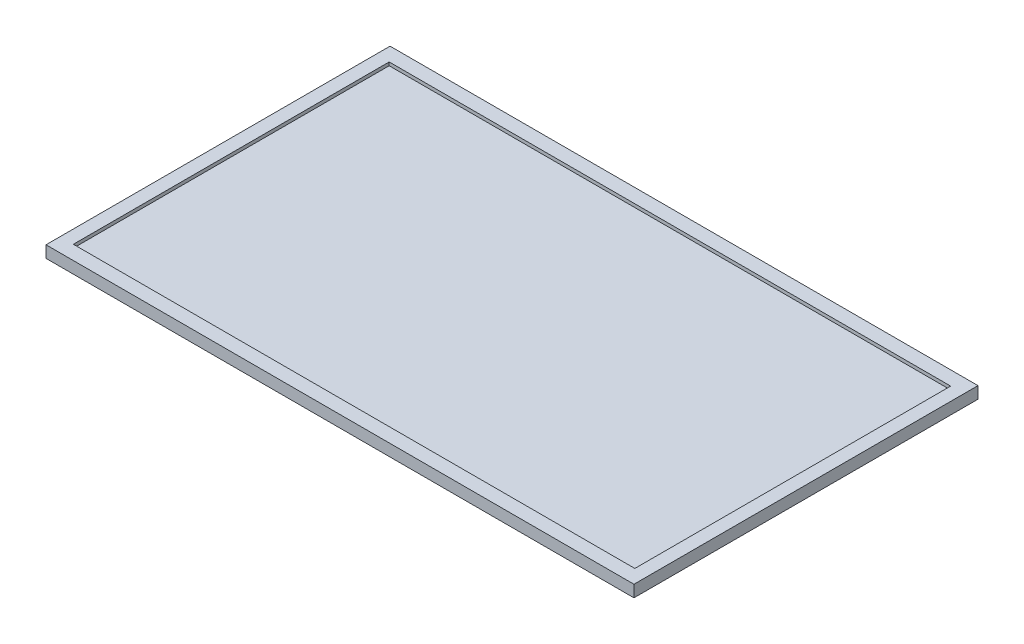
from build123d import *

# Parameters (mm, degrees)
CROQUIS1_W              = 533.2
CROQUIS1_H              = 312
SALIENTE_EXTRUIR1_DEPTH = 10.7
CROQUIS2_W              = 509.184
CROQUIS2_H              = 286.416
CORTAR_EXTRUIR1_DEPTH   = 3


with BuildPart() as part:
    # Croquis1 → Saliente-Extruir1 (new body)
    with BuildSketch(Plane(origin=(0, 0, 0), x_dir=(1, 0, 0), z_dir=(0, 1, 0))):
        with Locations((266.6, 156)):
            Rectangle(CROQUIS1_W, CROQUIS1_H)
    extrude(amount=SALIENTE_EXTRUIR1_DEPTH)

    # Croquis2 → Cortar-Extruir1 (cut)
    with BuildSketch(Plane(origin=(0, 10.7, 0), x_dir=(1, 0, 0), z_dir=(0, 1, 0))):
        with Locations((266.6, 156)):
            Rectangle(CROQUIS2_W, CROQUIS2_H)
    extrude(amount=-CORTAR_EXTRUIR1_DEPTH, mode=Mode.SUBTRACT)


solid = part.part
